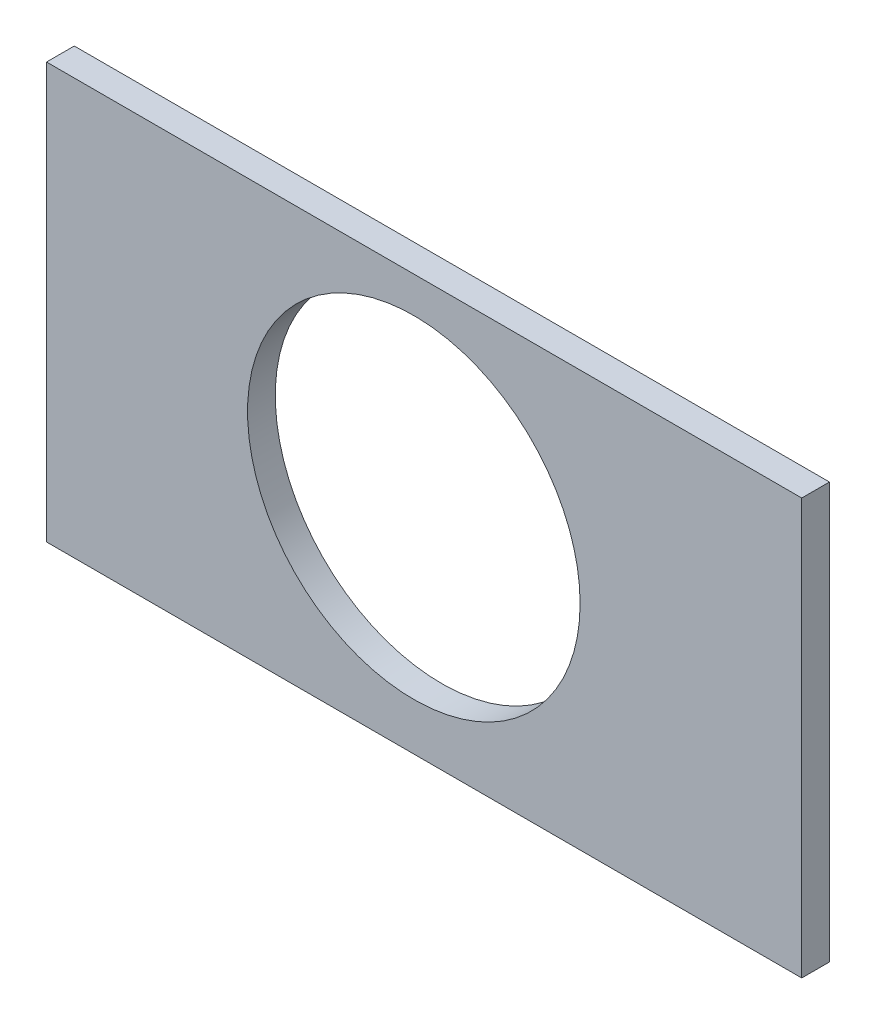
from build123d import *

# Parameters (mm, degrees)
SKETCH1_W           = 54.5
SKETCH1_H           = 30
SKETCH1_R           = 12
BOSS_EXTRUDE1_DEPTH = 2


with BuildPart() as part:
    # Sketch1 → Boss-Extrude1 (new body)
    with BuildSketch(Plane.XY):
        Rectangle(SKETCH1_W, SKETCH1_H)
        with Locations((-0.743755418, 0.409406652)):
            Circle(SKETCH1_R, mode=Mode.SUBTRACT)
    extrude(amount=BOSS_EXTRUDE1_DEPTH)


solid = part.part
